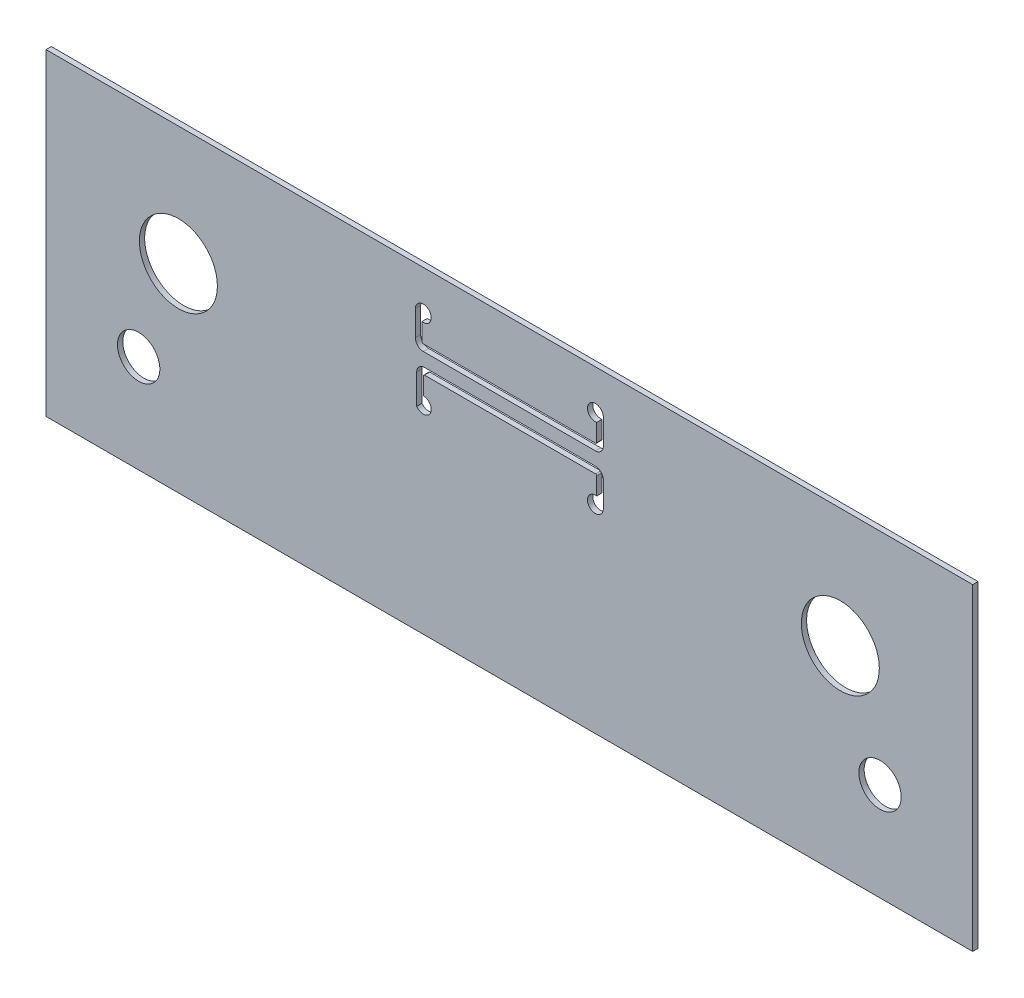
from build123d import *

# Parameters (mm, degrees)
SKETCH1_W           = 35
SKETCH1_H           = 12
SKETCH1_R           = 0.8001
SKETCH1_R_2         = 1.4732
BOSS_EXTRUDE1_DEPTH = 0.2


with BuildPart() as part:
    # Sketch1 → Boss-Extrude1 (new body)
    with BuildSketch(Plane.XY):
        with Locations((17.5, -6)):
            Rectangle(SKETCH1_W, SKETCH1_H)
        with Locations((3.5, -8.3)):
            Circle(SKETCH1_R, mode=Mode.SUBTRACT)
        with Locations((5, -4.5)):
            Circle(SKETCH1_R_2, mode=Mode.SUBTRACT)
        with Locations((30, -4.5)):
            Circle(SKETCH1_R_2, mode=Mode.SUBTRACT)
        with Locations((31.5, -8.3)):
            Circle(SKETCH1_R, mode=Mode.SUBTRACT)
        with BuildLine():
            Line((14.2, -1.795803989), (14.2, -2.45))
            ThreePointArc((14.2, -2.45), (14.214644661, -2.485355339), (14.25, -2.5))
            Line((14.25, -2.5), (20.75, -2.5))
            ThreePointArc((20.75, -2.5), (20.785355339, -2.485355339), (20.8, -2.45))
            Line((20.8, -2.45), (20.8, -1.795803989))
            ThreePointArc((20.8, -1.795803989), (20.520871215, -1.306350833), (21.05, -1.5))
            Line((21.05, -1.5), (21.05, -2.45))
            ThreePointArc((21.05, -2.45), (20.962132034, -2.662132034), (20.75, -2.75))
            Line((20.75, -2.75), (14.25, -2.75))
            ThreePointArc((14.25, -2.75), (14.037867966, -2.662132034), (13.95, -2.45))
            Line((13.95, -2.45), (13.95, -1.5))
            ThreePointArc((13.95, -1.5), (14.479128785, -1.306350833), (14.2, -1.795803989))
        make_face(mode=Mode.SUBTRACT)
        with BuildLine():
            Line((14.25, -4.2), (14.25, -3.55))
            ThreePointArc((14.25, -3.55), (14.264644661, -3.514644661), (14.3, -3.5))
            Line((14.3, -3.5), (20.75, -3.5))
            ThreePointArc((20.75, -3.5), (20.785355339, -3.514644661), (20.8, -3.55))
            Line((20.8, -3.55), (20.8, -4.204196011))
            ThreePointArc((20.8, -4.204196011), (20.520871215, -4.693649167), (21.05, -4.5))
            Line((21.05, -4.5), (21.05, -3.55))
            ThreePointArc((21.05, -3.55), (20.962132034, -3.337867966), (20.75, -3.25))
            Line((20.75, -3.25), (14.3, -3.25))
            ThreePointArc((14.3, -3.25), (14.087867966, -3.337867966), (14, -3.55))
            Line((14, -3.55), (14, -4.66583124))
            ThreePointArc((14, -4.66583124), (14.514338204, -4.641863717), (14.25, -4.2))
        make_face(mode=Mode.SUBTRACT)
    extrude(amount=BOSS_EXTRUDE1_DEPTH)


solid = part.part
